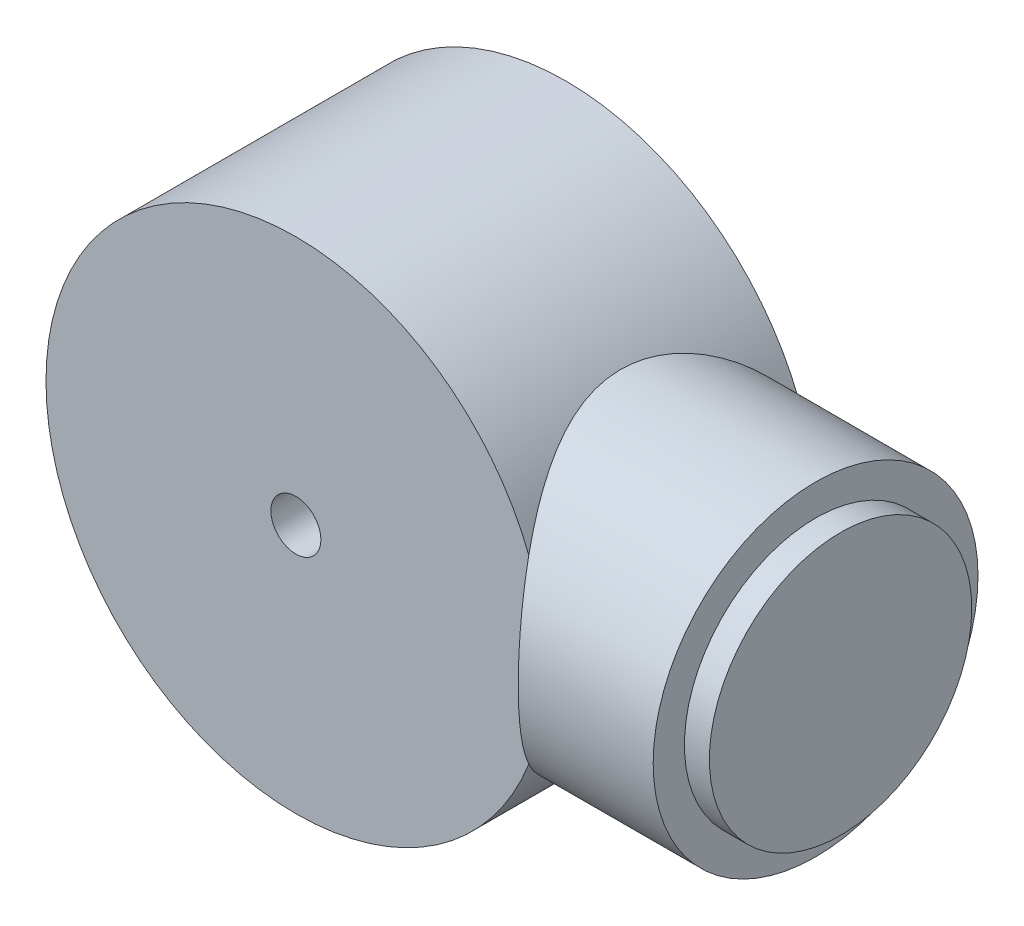
from build123d import *

# Parameters (mm, degrees)
SKETCH1_R                = 50
BOSS_EXTRUDE1_DEPTH      = 54
BOSS_EXTRUDE2_REACH      = 148.782
BOSS_EXTRUDE2_END_RADIUS = 50
SKETCH3_R                = 32.5
SKETCH4_R                = 26.25
BOSS_EXTRUDE3_DEPTH      = 5
SKETCH5_R                = 5
CUT_EXTRUDE1_DEPTH       = 500


with BuildPart() as part:
    # Sketch1 → Boss-Extrude1 (new body)
    with BuildSketch(Plane.XY):
        Circle(SKETCH1_R)
    extrude(amount=BOSS_EXTRUDE1_DEPTH)

    # Boss-Extrude2: up to this cylinder (the profile starts outside it)
    boss_extrude2_end = Plane(origin=(0, 0, 27), z_dir=(0, 0, -1)) * Cylinder(BOSS_EXTRUDE2_END_RADIUS, 398.564, mode=Mode.PRIVATE)
    # Sketch3 → Boss-Extrude2 (add, up to the surface)
    with BuildSketch(Plane(origin=(77, 0, 0), x_dir=(0, 0, -1), z_dir=(1, 0, 0)), mode=Mode.PRIVATE) as boss_extrude2_sk1:
        with Locations((-27, 0)):
            Circle(SKETCH3_R)
    boss_extrude2_tool1 = extrude(boss_extrude2_sk1.sketch, amount=-BOSS_EXTRUDE2_REACH, mode=Mode.PRIVATE) - boss_extrude2_end
    add(boss_extrude2_tool1.solids().sort_by_distance((77, 0, 27))[0])

    # Sketch4 → Boss-Extrude3 (add)
    with BuildSketch(Plane(origin=(77, 0, 0), x_dir=(0, 0, -1), z_dir=(1, 0, 0))):
        with Locations((-27, 0)):
            Circle(SKETCH4_R)
    extrude(amount=BOSS_EXTRUDE3_DEPTH)

    # Sketch5 → Cut-Extrude1 (cut)
    with BuildSketch(Plane.XY.offset(54)):
        Circle(SKETCH5_R)
    extrude(amount=-CUT_EXTRUDE1_DEPTH, mode=Mode.SUBTRACT)


solid = part.part
